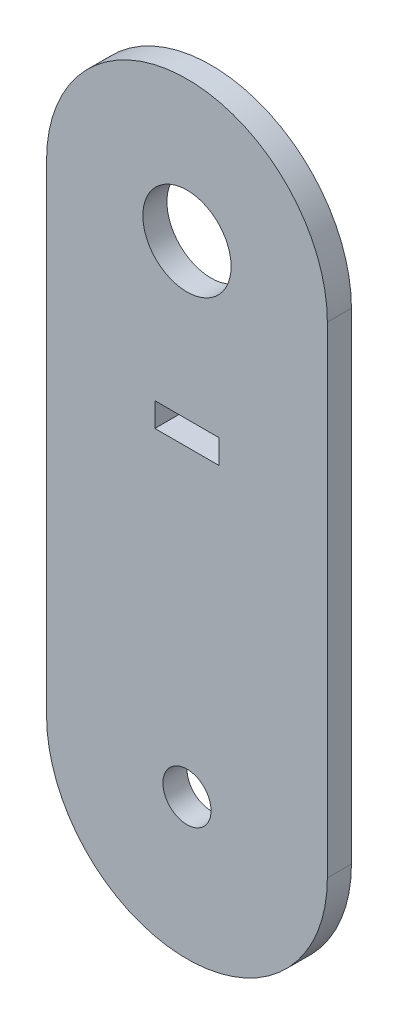
from build123d import *

# Parameters (mm, degrees)
CROQUIS1_R              = 5.5
CROQUIS1_R_2            = 3
SALIENTE_EXTRUIR1_DEPTH = 3
CORTAR_EXTRUIR1_REACH   = 52.71
CROQUIS2_W              = 8
CROQUIS2_H              = 3


with BuildPart() as part:
    # Croquis1 → Saliente-Extruir1 (new body)
    with BuildSketch(Plane.XY):
        with BuildLine():
            Line((-17.5, -30), (-17.5, 30))
            ThreePointArc((-17.5, 30), (0, 47.5), (17.5, 30))
            Line((17.5, 30), (17.5, -30))
            ThreePointArc((17.5, -30), (0, -47.5), (-17.5, -30))
        make_face()
        with Locations((0, 30)):
            Circle(CROQUIS1_R, mode=Mode.SUBTRACT)
        with Locations((0, -30)):
            Circle(CROQUIS1_R_2, mode=Mode.SUBTRACT)
    extrude(amount=SALIENTE_EXTRUIR1_DEPTH)

    # Croquis2 → Cortar-Extruir1 (cut, up to next)
    with BuildSketch(Plane.XY.offset(3), mode=Mode.PRIVATE) as cortar_extruir1_sk1:
        with Locations((0, 9.27)):
            Rectangle(CROQUIS2_W, CROQUIS2_H)
    cortar_extruir1_tool1 = extrude(cortar_extruir1_sk1.sketch, amount=-CORTAR_EXTRUIR1_REACH, mode=Mode.PRIVATE) & part.part
    add(cortar_extruir1_tool1.solids().sort_by_distance((0, 9.27, 3))[0], mode=Mode.SUBTRACT)


solid = part.part
